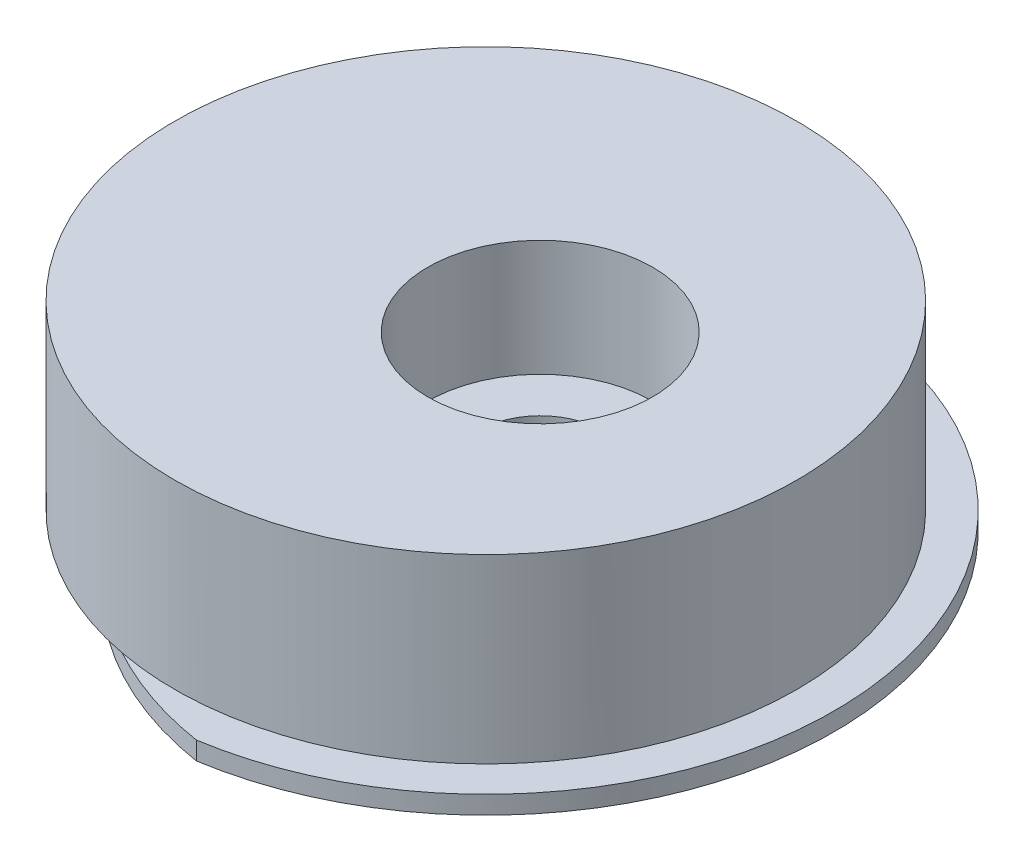
from build123d import *

# Parameters (mm, degrees)
BOSS_EXTRUDE1_DEPTH = 0.5
SKETCH2_R           = 8.575
BOSS_EXTRUDE2_DEPTH = 5
SKETCH3_R           = 1.59
SKETCH3_R_2         = 1.29
CUT_EXTRUDE1_DEPTH  = 4
SKETCH4_R           = 1.7
CUT_EXTRUDE2_DEPTH  = 15.888439307
SKETCH5_R           = 3.1
CUT_EXTRUDE3_DEPTH  = 3.2


with BuildPart() as part:
    # Sketch1 → Boss-Extrude1 (new body)
    with BuildSketch(Plane(origin=(0, 0, 0), x_dir=(1, 0, 0), z_dir=(0, 1, 0))):
        with BuildLine():
            ThreePointArc((8.1, 0), (5.799315036, 6.235382907), (0, 9.482088378))
            ThreePointArc((0, 9.482088378), (-8.1, 0), (0, -9.482088378))
            ThreePointArc((0, -9.482088378), (5.799315036, -6.235382907), (8.1, 0))
        make_face()
    extrude(amount=BOSS_EXTRUDE1_DEPTH)

    # Sketch2 → Boss-Extrude2 (add)
    with BuildSketch(Plane(origin=(0, 0.5, 0), x_dir=(1, 0, 0), z_dir=(0, 1, 0))):
        with Locations(Location((-1.5, 0, 0), (0, 0, 100.787083295))):
            Circle(SKETCH2_R)
    extrude(amount=BOSS_EXTRUDE2_DEPTH)

    # Sketch3 → Cut-Extrude1 (cut)
    with BuildSketch(Plane(origin=(0, 0, 0), x_dir=(1, 0, 0), z_dir=(0, 1, 0))):
        with Locations(Location((0, 5.8, 0), (0, 0, 270))):
            Circle(SKETCH3_R)
        with Locations(Location((0, -5.8, 0), (0, 0, 270))):
            Circle(SKETCH3_R_2)
    extrude(amount=CUT_EXTRUDE1_DEPTH, mode=Mode.SUBTRACT)

    # Sketch4 → Cut-Extrude2 (cut, through all)
    with BuildSketch(Plane(origin=(0, 5.5, 0), x_dir=(1, 0, 0), z_dir=(0, 1, 0))):
        with Locations(Location((0, 0, 0), (0, 0, 270))):
            Circle(SKETCH4_R)
    extrude(amount=-CUT_EXTRUDE2_DEPTH, mode=Mode.SUBTRACT)

    # Sketch5 → Cut-Extrude3 (cut)
    with BuildSketch(Plane(origin=(0, 5.5, 0), x_dir=(1, 0, 0), z_dir=(0, 1, 0))):
        with Locations(Location((0, 0, 0), (0, 0, 270))):
            Circle(SKETCH5_R)
    extrude(amount=-CUT_EXTRUDE3_DEPTH, mode=Mode.SUBTRACT)


solid = part.part
